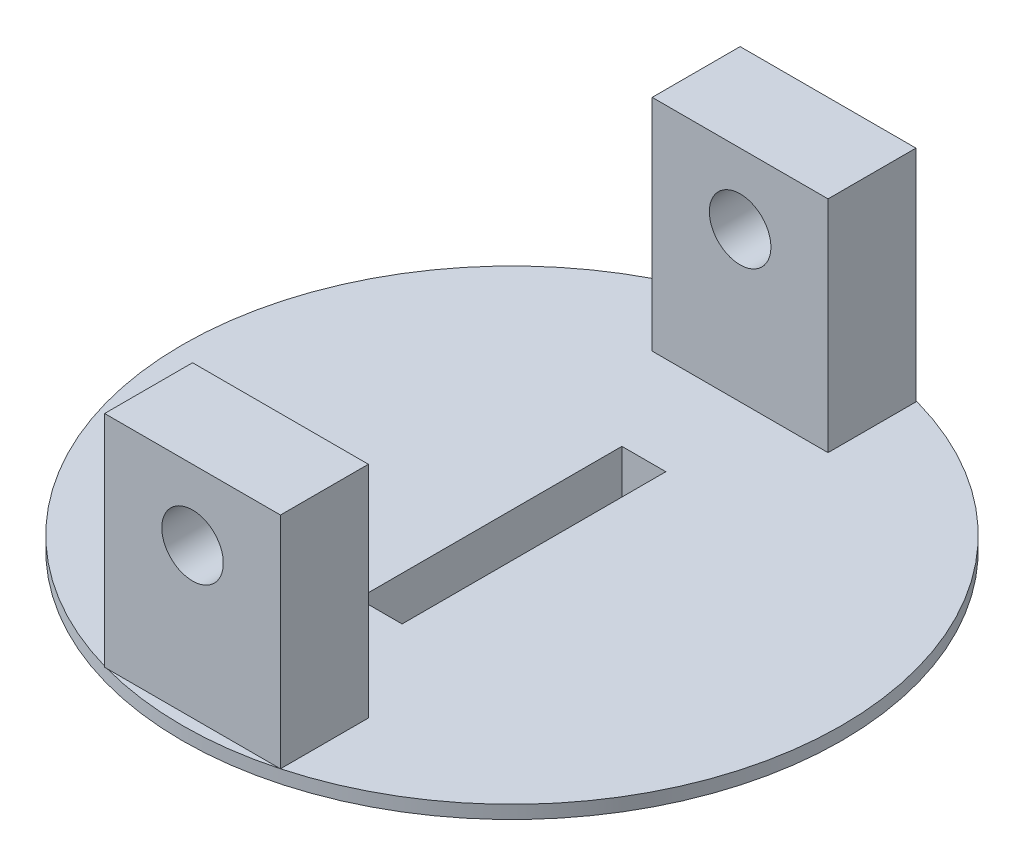
from build123d import *

# Parameters (mm, degrees)
ESQUISSE1_R             = 37.5
BOSS_EXTRU_1_DEPTH      = 1.5
ESQUISSE2_R             = 17.5
BOSS_EXTRU_2_DEPTH      = 8
ESQUISSE4_W             = 20
ESQUISSE4_H             = 72.283474197
BOSS_EXTRU_5_DEPTH      = 25
ESQUISSE11_W            = 52.283474197
ESQUISSE11_H            = 25
ENL_V_MAT_EXTRU_5_DEPTH = 25
ESQUISSE12_R            = 3.5
ENL_V_MAT_EXTRU_8_DEPTH = 87.749161989
ESQUISSE13_W            = 5
ESQUISSE13_H            = 30
ENL_V_MAT_EXTRU_9_DEPTH = 12


with BuildPart() as part:
    # Esquisse1 → Boss.-Extru.1 (new body)
    with BuildSketch(Plane(origin=(0, 0, 0), x_dir=(1, 0, 0), z_dir=(0, 1, 0))):
        with Locations(Location((0, 0, 0), (0, 0, 270))):
            Circle(ESQUISSE1_R)
    extrude(amount=BOSS_EXTRU_1_DEPTH)

    # Esquisse2 → Boss.-Extru.2 (add)
    with BuildSketch(Plane(origin=(0, 1.5, 0), x_dir=(1, 0, 0), z_dir=(0, 1, 0))):
        with Locations(Location((0, 0, 0), (0, 0, 270))):
            Circle(ESQUISSE2_R)
    extrude(amount=-BOSS_EXTRU_2_DEPTH)

    # Esquisse4 → Boss.-Extru.5 (add)
    with BuildSketch(Plane(origin=(0, 1.5, 0), x_dir=(1, 0, 0), z_dir=(0, 1, 0))):
        with Locations((-0.151898301, -0.042028501)):
            Rectangle(ESQUISSE4_W, ESQUISSE4_H)
    extrude(amount=BOSS_EXTRU_5_DEPTH)

    # Esquisse11 → Enlèv. mat.-Extru.5 (cut)
    with BuildSketch(Plane(origin=(9.848101699, 0, 0), x_dir=(0, 0, -1), z_dir=(1, 0, 0))):
        with Locations((-0.0420285, 14)):
            Rectangle(ESQUISSE11_W, ESQUISSE11_H)
    extrude(amount=-ENL_V_MAT_EXTRU_5_DEPTH, mode=Mode.SUBTRACT)

    # Esquisse12 → Enlèv. mat.-Extru.8 (cut, through all)
    with BuildSketch(Plane(origin=(0, 0, -36.099708598), x_dir=(-1, 0, 0), z_dir=(0, 0, -1))):
        with Locations((0.151898301, 18.5)):
            Circle(ESQUISSE12_R)
    extrude(amount=-ENL_V_MAT_EXTRU_8_DEPTH, mode=Mode.SUBTRACT)

    # Esquisse13 → Enlèv. mat.-Extru.9 (cut)
    with BuildSketch(Plane(origin=(0, 1.5, 0), x_dir=(1, 0, 0), z_dir=(0, 1, 0))):
        Rectangle(ESQUISSE13_W, ESQUISSE13_H)
    extrude(amount=-ENL_V_MAT_EXTRU_9_DEPTH, mode=Mode.SUBTRACT)


solid = part.part
